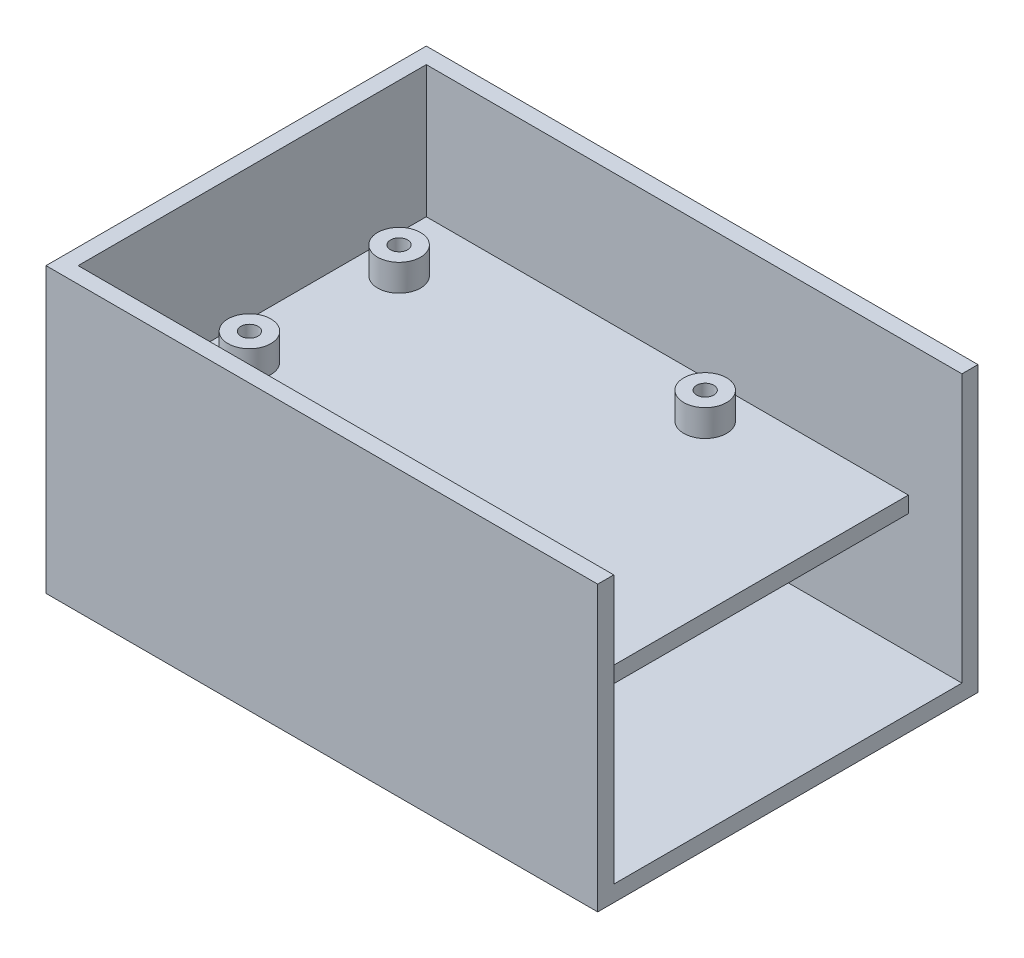
from build123d import *

# Parameters (mm, degrees)
SKETCH2_W           = 100
SKETCH2_H           = 65
BOSS_EXTRUDE1_DEPTH = 50
SHELL1_T            = 3
SKETCH7_W           = 65
SKETCH7_H           = 3
BOSS_EXTRUDE3_DEPTH = 100
CUT_EXTRUDE1_REACH  = 71.827
SKETCH3_W           = 10
SKETCH3_H           = 65
SKETCH4_R           = 4
SKETCH4_R_2         = 1.6
BOSS_EXTRUDE4_DEPTH = 5


with BuildPart() as part:
    # Sketch2 → Boss-Extrude1 (new body)
    with BuildSketch(Plane(origin=(0, 0, 0), x_dir=(1, 0, 0), z_dir=(0, 1, 0))):
        Rectangle(SKETCH2_W, SKETCH2_H)
    extrude(amount=BOSS_EXTRUDE1_DEPTH)

    # Shell1
    shell1_openings = [part.faces().sort_by_distance(p)[0] for p in [
        (50, 25, 0),
        (0, 50, 0),
    ]]
    offset(amount=SHELL1_T, openings=shell1_openings, kind=Kind.INTERSECTION)

    # Sketch7 → Boss-Extrude3 (add)
    with BuildSketch(Plane(origin=(-50, 0, 0), x_dir=(0, 0, -1), z_dir=(1, 0, 0))):
        with Locations((0, 23.9)):
            Rectangle(SKETCH7_W, SKETCH7_H)
    extrude(amount=BOSS_EXTRUDE3_DEPTH)

    # Sketch3 → Cut-Extrude1 (cut, up to next)
    with BuildSketch(Plane(origin=(0, 25.4, 0), x_dir=(1, 0, 0), z_dir=(0, 1, 0)), mode=Mode.PRIVATE) as cut_extrude1_sk1:
        with Locations((45, 0)):
            Rectangle(SKETCH3_W, SKETCH3_H)
    cut_extrude1_tool1 = extrude(cut_extrude1_sk1.sketch, amount=-CUT_EXTRUDE1_REACH, mode=Mode.PRIVATE) & part.part
    add(cut_extrude1_tool1.solids().sort_by_distance((45, 25.4, 0))[0], mode=Mode.SUBTRACT)

    # Sketch4 → Boss-Extrude4 (add)
    # profile 1 of 4: a face of its own
    with BuildSketch(Plane(origin=(0, 25.4, 0), x_dir=(1, 0, 0), z_dir=(0, 1, 0))):
        with Locations(Location((9.07, 25.5, 0), (0, 0, 90))):
            Circle(SKETCH4_R)
        with Locations(Location((9.07, 25.5, 0), (0, 0, 270))):
            Circle(SKETCH4_R_2, mode=Mode.SUBTRACT)
    # profile 2 of 4: a face of its own
    with BuildSketch(Plane(origin=(0, 25.4, 0), x_dir=(1, 0, 0), z_dir=(0, 1, 0))):
        with Locations(Location((7.8, -22.76, 0), (0, 0, 90))):
            Circle(SKETCH4_R)
        with Locations(Location((7.8, -22.76, 0), (0, 0, 270))):
            Circle(SKETCH4_R_2, mode=Mode.SUBTRACT)
    # profile 3 of 4: a face of its own
    with BuildSketch(Plane(origin=(0, 25.4, 0), x_dir=(1, 0, 0), z_dir=(0, 1, 0))):
        with Locations(Location((-43, -7.52, 0), (0, 0, 90))):
            Circle(SKETCH4_R)
        with Locations(Location((-43, -7.52, 0), (0, 0, 270))):
            Circle(SKETCH4_R_2, mode=Mode.SUBTRACT)
    # profile 4 of 4: a face of its own
    with BuildSketch(Plane(origin=(0, 25.4, 0), x_dir=(1, 0, 0), z_dir=(0, 1, 0))):
        with Locations(Location((-43, 20.42, 0), (0, 0, 90))):
            Circle(SKETCH4_R)
        with Locations(Location((-43, 20.42, 0), (0, 0, 270))):
            Circle(SKETCH4_R_2, mode=Mode.SUBTRACT)
    extrude(amount=BOSS_EXTRUDE4_DEPTH)


solid = part.part
